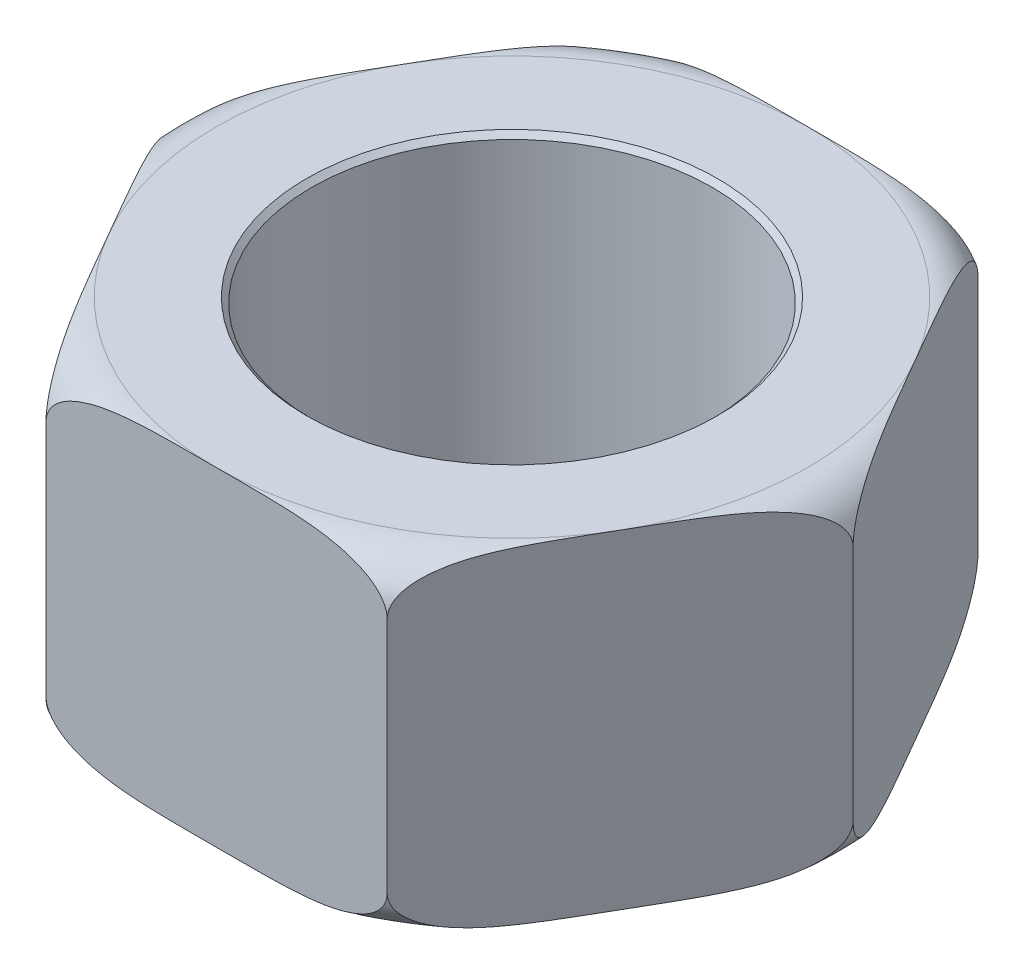
from build123d import *

# Parameters (mm, degrees)
BOSS_EXTRUDE1_DEPTH = 64
SKETCH6_R           = 78
CUT_EXTRUDE1_DEPTH  = 218.353015642
CHAMFER1_SIZE       = 2


with BuildPart() as part:
    # Sketch1 → Boss-Extrude1 (new, symmetric)
    with BuildSketch(Plane(origin=(0, 0, 0), x_dir=(1, 0, 0), z_dir=(0, 1, 0))):
        Polygon((132.790561914, 0), (66.395280957, 115), (-66.395280957, 115), (-132.790561914, 0), (-66.395280957, -115), (66.395280957, -115), align=None)
    extrude(amount=BOSS_EXTRUDE1_DEPTH, both=True)

    # Sketch3 → Cut-Revolve1 (revolve, cut)
    with BuildSketch(Plane.XY):
        with BuildLine():
            Line((-132.790561914, 64), (-132.790561914, 46.209438086))
            ThreePointArc((-132.790561914, 46.209438086), (-127.57982697, 58.789265057), (-115, 64))
            Line((-115, 64), (-132.790561914, 64))
        make_face()
    cut_revolve1 = revolve(axis=Axis((0, -11.068960952, 0), (0, -1, 0)), mode=Mode.SUBTRACT)

    # Mirror1: Cut-Revolve1 across plane
    add(cut_revolve1.mirror(Plane.ZX), mode=Mode.SUBTRACT)

    # Sketch6 → Cut-Extrude1 (cut, through all)
    with BuildSketch(Plane(origin=(0, 64, 0), x_dir=(1, 0, 0), z_dir=(0, 1, 0))):
        with Locations(Location((0, 0, 0), (0, 0, 270))):
            Circle(SKETCH6_R)
    extrude(amount=-CUT_EXTRUDE1_DEPTH, mode=Mode.SUBTRACT)

    # Chamfer1
    chamfer1_edges = [part.edges().sort_by_distance(p)[0] for p in [
        (0, -64, -78),
        (0, 64, -78),
    ]]
    chamfer(chamfer1_edges, length=CHAMFER1_SIZE)


solid = part.part
